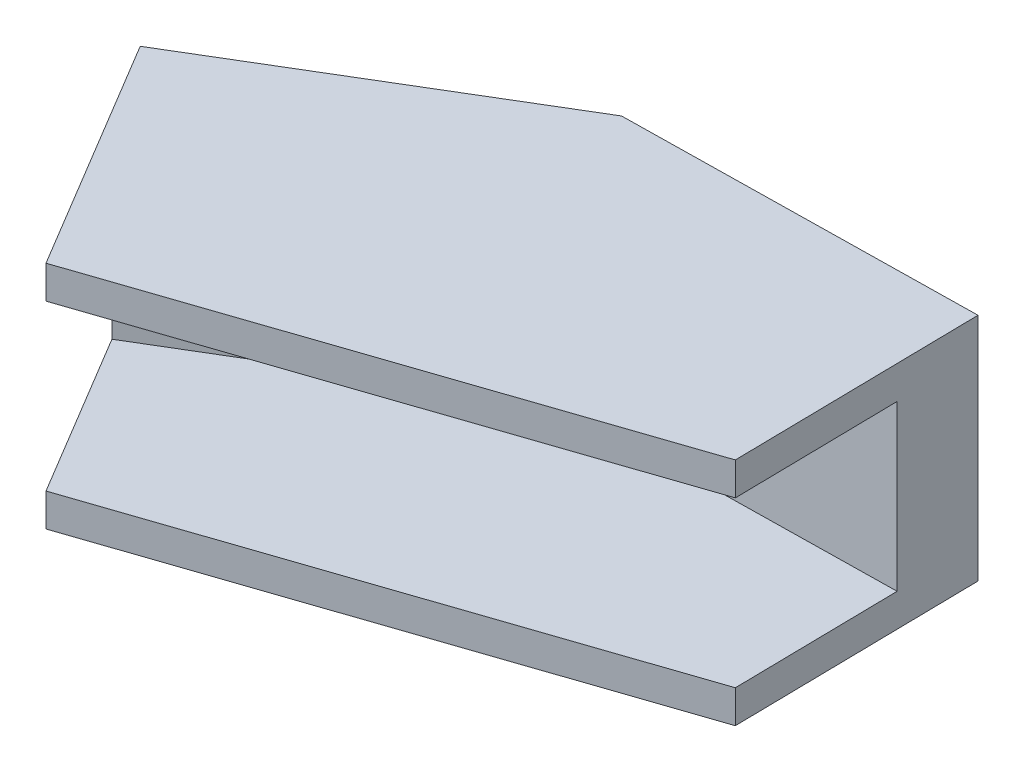
from build123d import *

# Parameters (mm, degrees)
BOSS_EXTRUDE1_DEPTH = 10
BOSS_EXTRUDE2_DEPTH = 2


with BuildPart() as part:
    # Sketch3 → Boss-Extrude1 (new body)
    with BuildSketch(Plane(origin=(0, 0, 0), x_dir=(1, 0, 0), z_dir=(0, 1, 0))):
        Polygon((19.916769016, 5.321871098), (19.997399332, 0.322521265), (0, 0), (-17.156995198, -10.278011275), (-19.726498017, -5.988762475), (-1.420202067, 4.977745005), align=None)
    extrude(amount=BOSS_EXTRUDE1_DEPTH)

    # Sketch4 → Boss-Extrude2 (add)
    with BuildSketch(Plane(origin=(0, 10, 0), x_dir=(1, 0, 0), z_dir=(0, 1, 0))):
        Polygon((-19.726498017, -5.988762475), (-17.156995198, -10.278011275), (-11.166429161, -20.278011275), (20.158680936, -9.677478735), (19.997399332, 0.322521265), (19.916769016, 5.321871098), (-1.420202067, 4.977745005), align=None)
    boss_extrude2 = extrude(amount=BOSS_EXTRUDE2_DEPTH)

    # Mirror1: Boss-Extrude2 across plane
    add(boss_extrude2.mirror(Plane.ZX.offset(5)))


solid = part.part
